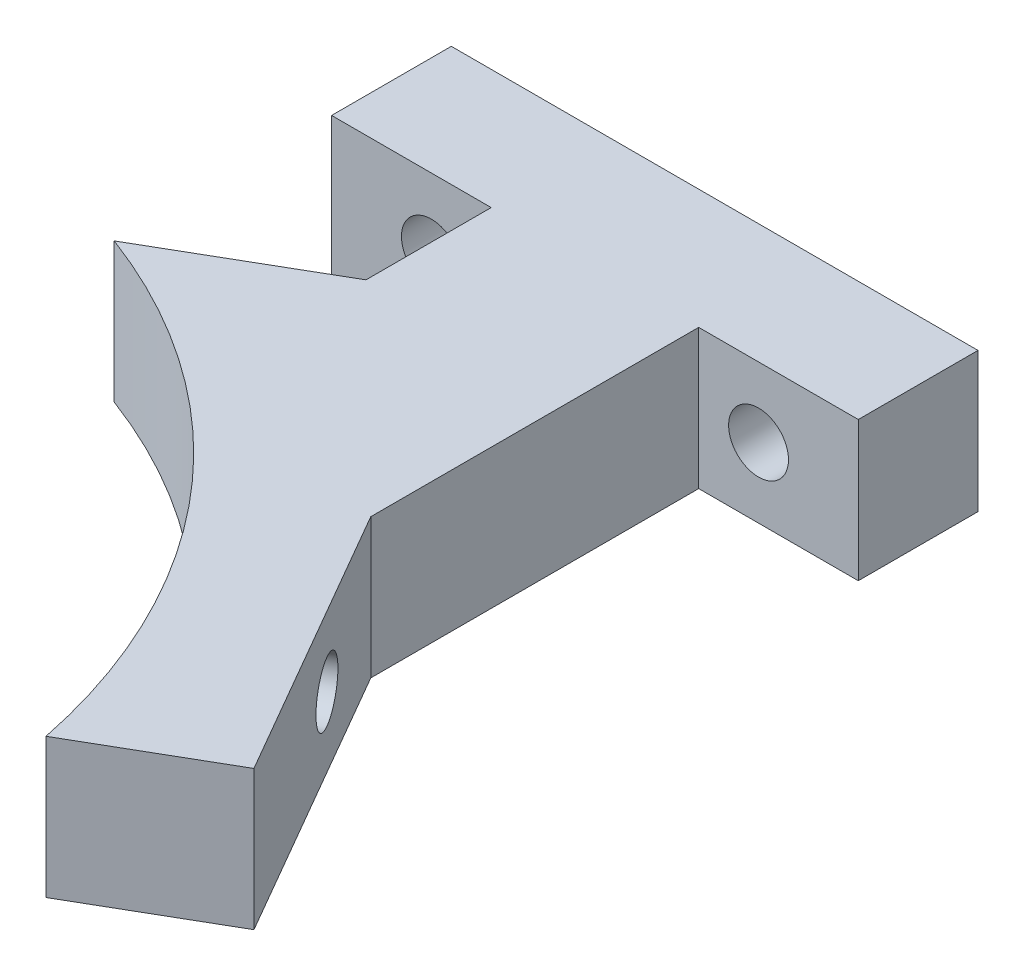
from build123d import *
from build123d.topology import SkipClean

# Parameters (mm, degrees)
SKETCH1_R                            = 31.5
BOSS_EXTRUDE1_DEPTH                  = 3.5
SKETCH2_R                            = 1.5
CUT_EXTRUDE1_DEPTH                   = 4
CIRPATTERN1_COUNT                    = 6
SKETCH3_W                            = 30
SKETCH3_H                            = 7
SKETCH3_R                            = 1.5
BOSS_EXTRUDE2_DEPTH                  = 6
BOSS_EXTRUDE2_DIRECTION_2_REACH      = 77.498
BOSS_EXTRUDE2_DIRECTION_2_END_RADIUS = 31.5
SKETCH6_W                            = 26.400196428
SKETCH6_H                            = 7
SKETCH6_R                            = 1.5
BOSS_EXTRUDE3_DEPTH                  = 6
BOSS_EXTRUDE4_REACH                  = 83.142
SKETCH7_W                            = 10.400196428
SKETCH7_H                            = 7


with BuildPart() as part:
    # Sketch1 → Boss-Extrude1 (new, symmetric)
    with BuildSketch(Plane(origin=(0, 0, 0), x_dir=(1, 0, 0), z_dir=(0, 1, 0))):
        Circle(SKETCH1_R)
    extrude(amount=BOSS_EXTRUDE1_DEPTH, both=True)

    # Sketch2 → Cut-Extrude1 (cut)
    with BuildSketch(Plane(origin=(27.279800219, 0, -15.75), x_dir=(-0.499999999999998, 0, -0.8660254037844398), z_dir=(0.8660254037844399, 0, -0.49999999999999806))):
        Circle(SKETCH2_R)
    cut_extrude1 = extrude(amount=-CUT_EXTRUDE1_DEPTH, mode=Mode.SUBTRACT)

    # CirPattern1: Cut-Extrude1 ×6 about axis
    cirpattern1_axis = Axis((0, -3.5, 0), (0, 1, 0))
    for i in range(1, CIRPATTERN1_COUNT):
        add(cut_extrude1.rotate(cirpattern1_axis, i * 360 / CIRPATTERN1_COUNT), mode=Mode.SUBTRACT)


with BuildPart() as body_2:
    # Sketch3 → Boss-Extrude2 (new body)
    with BuildSketch(Plane(origin=(27.279800219, 0, -15.75), x_dir=(-0.499999999999998, 0, -0.8660254037844398), z_dir=(0.8660254037844399, 0, -0.49999999999999806))):
        with Locations((5, 0)):
            Rectangle(SKETCH3_W, SKETCH3_H)
        Circle(SKETCH3_R, mode=Mode.SUBTRACT)
    extrude(amount=BOSS_EXTRUDE2_DEPTH)

    # Boss-Extrude2 direction 2: up to this cylinder (the profile starts outside it)
    with SkipClean():  # the faces are left unmerged after this step: merging them gives an invalid solid
        boss_extrude2_direction_2_end = Plane(origin=(0, 0, 0), z_dir=(0, 1, 0)) * Cylinder(BOSS_EXTRUDE2_DIRECTION_2_END_RADIUS, 218.996, mode=Mode.PRIVATE)
        # Sketch3 → Boss-Extrude2 direction 2 (add, up to the surface)
        with BuildSketch(Plane(origin=(27.279800219, 0, -15.75), x_dir=(-0.499999999999998, 0, -0.8660254037844398), z_dir=(0.8660254037844399, 0, -0.49999999999999806)), mode=Mode.PRIVATE) as boss_extrude2_direction_2_sk1:
            with Locations((5, 0)):
                Rectangle(SKETCH3_W, SKETCH3_H)
            Circle(SKETCH3_R, mode=Mode.SUBTRACT)
        boss_extrude2_direction_2_tool1 = extrude(boss_extrude2_direction_2_sk1.sketch, amount=-BOSS_EXTRUDE2_DIRECTION_2_REACH, mode=Mode.PRIVATE) - boss_extrude2_direction_2_end
        add(boss_extrude2_direction_2_tool1.solids().sort_by_distance((24.692719, 0, -20.230956))[0])
        add(boss_extrude2_direction_2_tool1.solids().sort_by_distance((24.692719, 0, -20.230956))[1])

    # Sketch7 → Boss-Extrude4 (add, up to next)
    with BuildSketch(Plane.XY.offset(-40.383857754), mode=Mode.PRIVATE) as boss_extrude4_sk1:
        with Locations((24.275854428, 0)):
            Rectangle(SKETCH7_W, SKETCH7_H)
    boss_extrude4_tool1 = extrude(boss_extrude4_sk1.sketch, amount=BOSS_EXTRUDE4_REACH, mode=Mode.PRIVATE) - body_2.part


with BuildPart() as body_3:
    # Sketch6 → Boss-Extrude3 (new body)
    with BuildSketch(Plane.XY.offset(-46.383857754)):
        with Locations((24.275854428, 0)):
            Rectangle(SKETCH6_W, SKETCH6_H)
        with Locations((32.475952642, 0)):
            Circle(SKETCH6_R, mode=Mode.SUBTRACT)
        with Locations((16.075756214, 0)):
            Circle(SKETCH6_R, mode=Mode.SUBTRACT)
    extrude(amount=BOSS_EXTRUDE3_DEPTH)


with BuildPart() as body_2_1:
    add(body_2.part)

    add(body_3.part)  # Boss-Extrude4 merges body 3
    add(boss_extrude4_tool1.solids().sort_by_distance((24.275854, 0, -40.383858))[0])


solid = body_2_1.part
